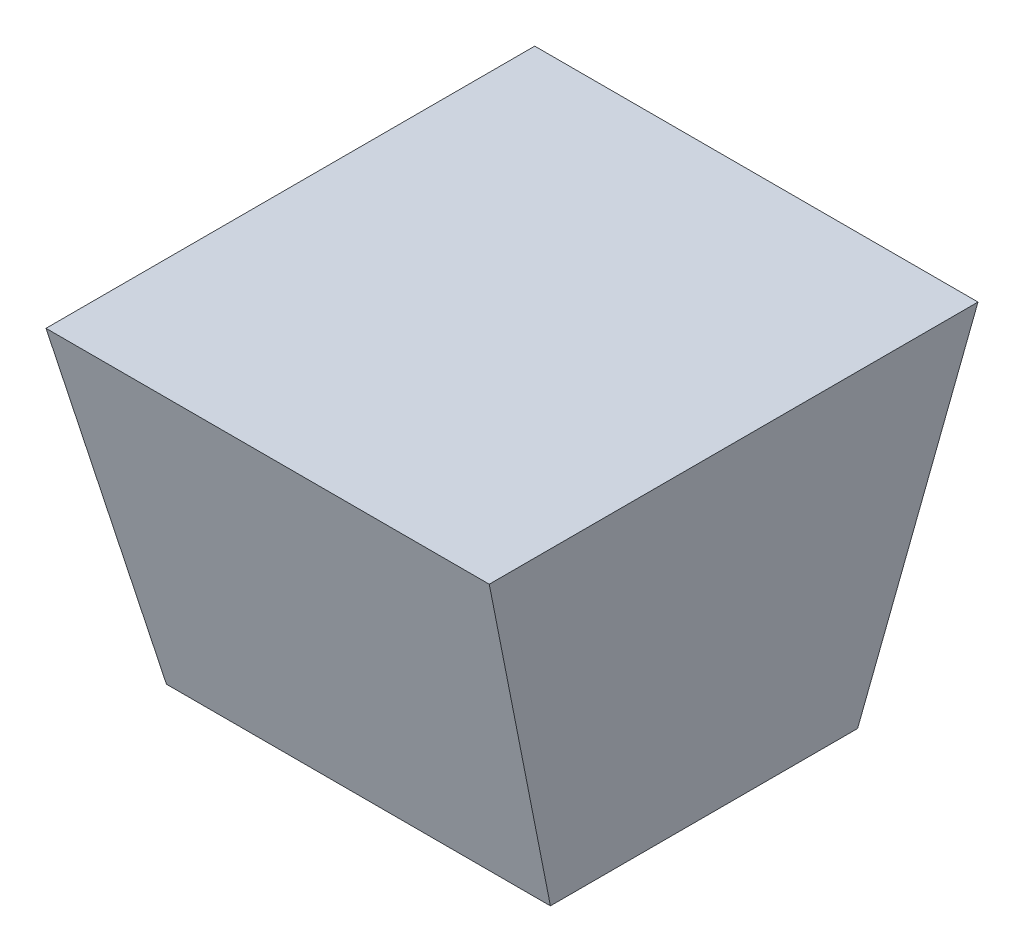
from build123d import *

# Parameters (mm, degrees)
TD_SKETCH_R            = 1.58623
TL_FEATURE_DEPTH       = 63.5
TDF_FEATURE_DEPTH      = 64.53961167
TDF_FEATURE_DEPTH_BACK = 64.53961167
ISA_FEATURE_DEPTH      = 64.53961167
ISA_FEATURE_DEPTH_BACK = 64.53961167
FL_FEATURE_DEPTH       = 64.53961167
FL_FEATURE_DEPTH_BACK  = 64.53961167


with BuildPart() as part:
    # TD_sketch → TL_feature (new body)
    with BuildSketch(Plane(origin=(0, 0, 0), x_dir=(1, 0, 0), z_dir=(0, 1, 0))):
        with Locations(Location((0, 0, 0), (0, 0, 270))):
            Circle(TD_SKETCH_R)
    extrude(amount=TL_FEATURE_DEPTH)

    # TDF_sketch → TDF_feature (cut, two sides: drawn at the far end of the back side and taken through both)
    with BuildSketch(Plane(origin=(0, 0, 0), x_dir=(1, 0, 0), z_dir=(0, 1, 0)).offset(-TDF_FEATURE_DEPTH_BACK)):
        Polygon((-1.20777, 18.681345175), (-1.20777, 1.02830795), (-1.20777, -1.02830795), (-1.20777, -18.681345175), (-36.51384445, -18.681345175), (-36.51384445, 18.681345175), align=None)
    extrude(amount=TDF_FEATURE_DEPTH + TDF_FEATURE_DEPTH_BACK, mode=Mode.SUBTRACT)

    # ISA_sketch → ISA_feature (cut, two sides: drawn at the far end of the back side and taken through both)
    with BuildSketch(Plane(origin=(0, 0, 0), x_dir=(0, 0, -1), z_dir=(1, 0, 0)).offset(-ISA_FEATURE_DEPTH_BACK)):
        Polygon((-34.760230828, 128.305036176), (-1.58623, 4.497979595), (-0.381, 0), (0.381, 0), (1.58623, 4.497979595), (34.760230828, 128.305036176), (34.760230828, -128.043957115), (-34.760230828, -128.043957115), align=None)
    extrude(amount=ISA_FEATURE_DEPTH + ISA_FEATURE_DEPTH_BACK, mode=Mode.SUBTRACT)

    # FL_sketch → FL_feature (cut, two sides: drawn at the far end of the back side and taken through both)
    with BuildSketch(Plane.XY.offset(-FL_FEATURE_DEPTH_BACK)):
        Polygon((11.853994274, 127.028849521), (1.58623, 9.667766839), (0.74041, 0), (-0.21209, 0), (-1.20777, 11.380674477), (-11.475534274, 128.741757159), (-28.728763789, -106.244474177), (-5.399235241, -107.957381815), align=None)
    extrude(amount=FL_FEATURE_DEPTH + FL_FEATURE_DEPTH_BACK, mode=Mode.SUBTRACT)

    # cut_feature
    split(bisect_by=Plane(origin=(0, 0.840435033, 0), x_dir=(1, 0, 0), z_dir=(0, 1, 0)), keep=Keep.BOTTOM)


solid = part.part
